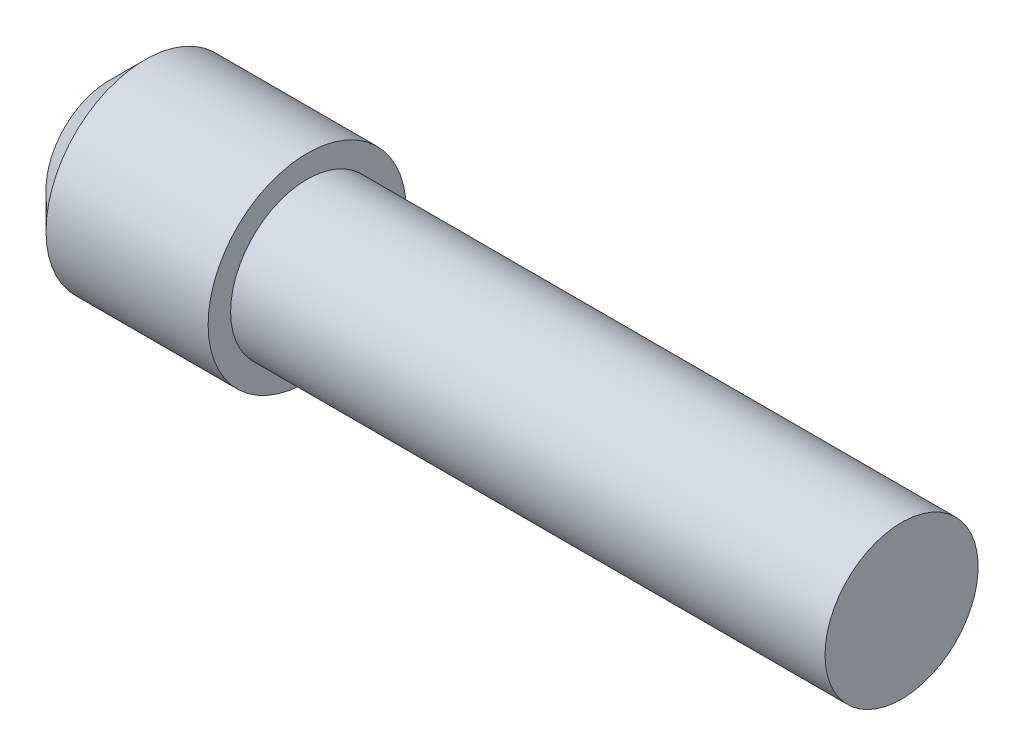
from build123d import *

# Parameters (mm, degrees)
CHAMFER1_SIZE = 1


with BuildPart() as part:
    # Sketch1 → Revolve1 (revolve)
    with BuildSketch(Plane.XY, mode=Mode.PRIVATE) as revolve1_sk:
        Polygon((0, 2.75), (-5.5, 2.75), (-5.5, 0), (16.5, 0), (16.5, 2.125), (0, 2.125), align=None)
    revolve(revolve1_sk.sketch.rotate(Axis((-9.458937198, 0, 0), (1, 0, 0)), 90), axis=Axis((-9.458937198, 0, 0), (1, 0, 0)))

    # Chamfer1
    chamfer1_edges = [part.edges().sort_by_distance(p)[0] for p in [
        (-5.5, 0, -2.75),
    ]]
    chamfer(chamfer1_edges, length=CHAMFER1_SIZE)


solid = part.part
